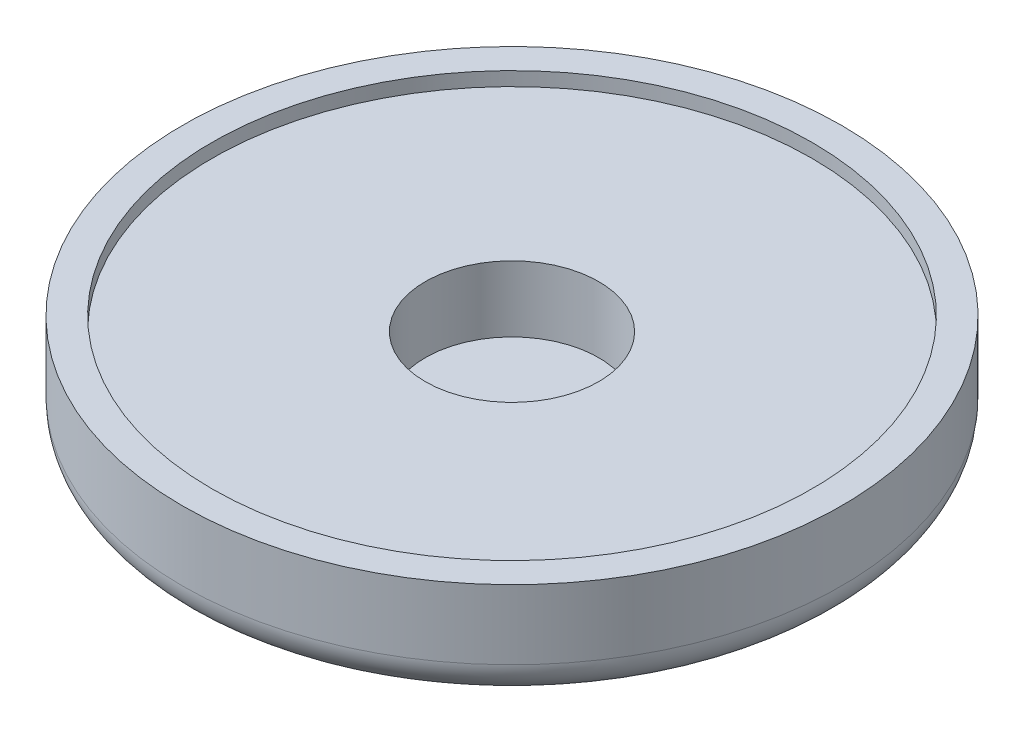
from build123d import *

# Parameters (mm, degrees)
SKETCH2_R           = 24.13
BOSS_EXTRUDE1_DEPTH = 7.62
SKETCH3_R           = 21.971
CUT_EXTRUDE1_DEPTH  = 1.016
SKETCH4_R           = 6.35
CUT_EXTRUDE2_DEPTH  = 4.826
FILLET1_R           = 2.54


with BuildPart() as part:
    # Sketch2 → Boss-Extrude1 (new body)
    with BuildSketch(Plane(origin=(0, 0, 0), x_dir=(1, 0, 0), z_dir=(0, 1, 0))):
        with Locations(Location((0, 0, 0), (0, 0, 90))):
            Circle(SKETCH2_R)
    extrude(amount=BOSS_EXTRUDE1_DEPTH)

    # Sketch3 → Cut-Extrude1 (cut)
    with BuildSketch(Plane(origin=(0, 7.62, 0), x_dir=(1, 0, 0), z_dir=(0, 1, 0))):
        with Locations(Location((0, 0, 0), (0, 0, 270))):
            Circle(SKETCH3_R)
    extrude(amount=-CUT_EXTRUDE1_DEPTH, mode=Mode.SUBTRACT)

    # Sketch4 → Cut-Extrude2 (cut)
    with BuildSketch(Plane(origin=(0, 6.604, 0), x_dir=(1, 0, 0), z_dir=(0, 1, 0))):
        with Locations(Location((0, 0, 0), (0, 0, 270))):
            Circle(SKETCH4_R)
    extrude(amount=-CUT_EXTRUDE2_DEPTH, mode=Mode.SUBTRACT)

    # Fillet1
    fillet1_edges = [part.edges().sort_by_distance(p)[0] for p in [
        (0, 0, 24.13),
    ]]
    fillet(fillet1_edges, radius=FILLET1_R)


solid = part.part
